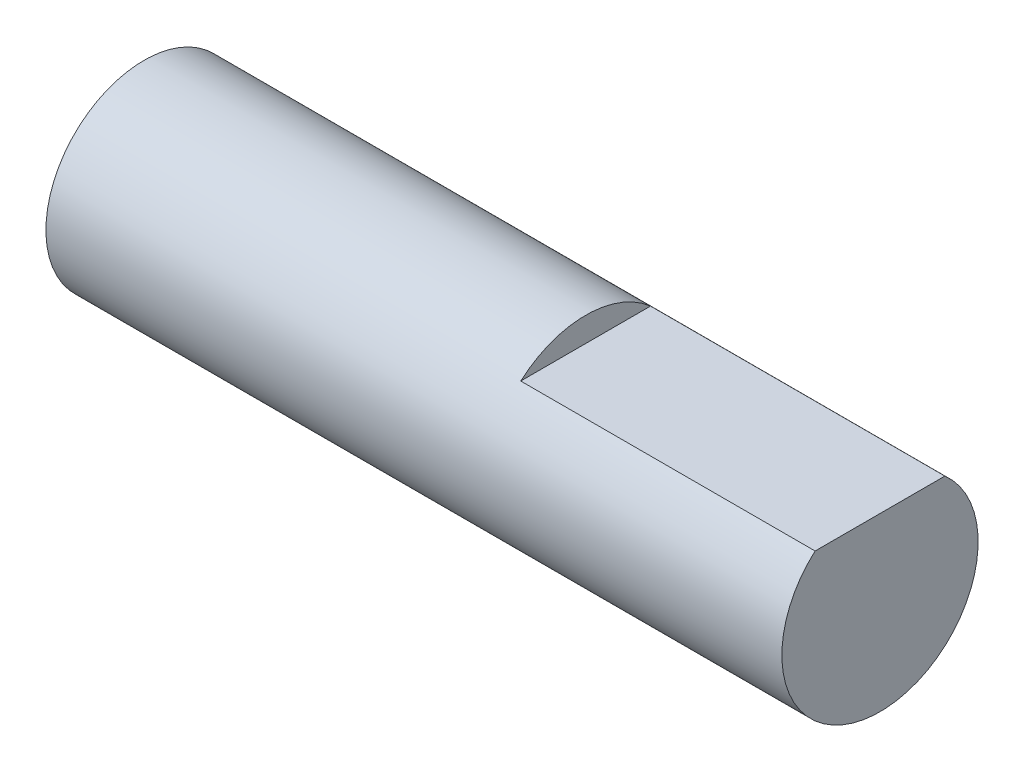
from build123d import *

# Parameters (mm, degrees)
SKETCH1_R           = 4
BOSS_EXTRUDE1_DEPTH = 30
CUT_EXTRUDE1_START  = -12
CUT_EXTRUDE1_DEPTH  = 12


with BuildPart() as part:
    # Sketch1 → Boss-Extrude1 (new body)
    with BuildSketch(Plane(origin=(0, 0, 0), x_dir=(0, 0, -1), z_dir=(1, 0, 0))):
        Circle(SKETCH1_R)
    extrude(amount=BOSS_EXTRUDE1_DEPTH)

    # Sketch2 → Cut-Extrude1 (cut)
    with BuildSketch(Plane(origin=(30, 0, 0), x_dir=(0, 0, -1), z_dir=(1, 0, 0)).offset(CUT_EXTRUDE1_START)):
        with BuildLine():
            Line((-2.645751311, 3), (2.645751311, 3))
            ThreePointArc((2.645751311, 3), (0, 4), (-2.645751311, 3))
        make_face()
    extrude(amount=CUT_EXTRUDE1_DEPTH, mode=Mode.SUBTRACT)


solid = part.part
